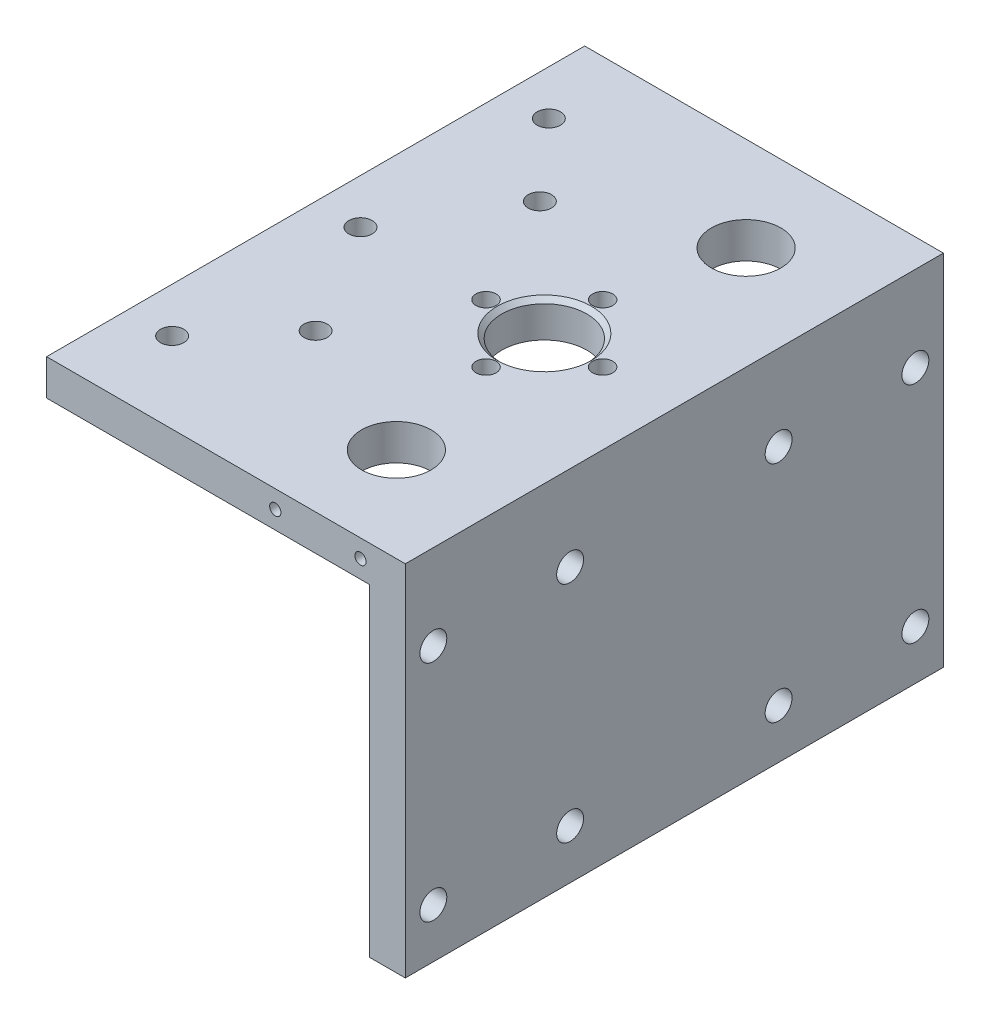
from build123d import *

# Parameters (mm, degrees)
ESTRUSIONE_ESTRUSIONE1_DEPTH = 120
TAGLIO_ESTRUSIONE2_REACH     = 166.924
SCHIZZO6_R                   = 7.75
TAGLIO_ESTRUSIONE3_REACH     = 166.924
SCHIZZO7_R                   = 9.5
FORO_PER_VITE_M4_2_D         = 4.5
SCHIZZO12_R                  = 3
TAGLIO_ESTRUSIONE4_DEPTH     = 10
SCHIZZO14_R                  = 2.6
TAGLIO_ESTRUSIONE5_DEPTH     = 10
SMUSSO2_SIZE                 = 1
FORO_FILETTATO_M3_1_D        = 2.5
FORO_FILETTATO_M3_1_DEPTH    = 10
FORO_FILETTATO_M3_1_TIP      = 0.751075774


with BuildPart() as part:
    # Schizzo1 → Estrusione-Estrusione1 (new body)
    with BuildSketch(Plane.XY):
        Polygon((0, 0), (-80, 0), (-80, -8), (-8, -8), (-8, -80), (0, -80), align=None)
    extrude(amount=ESTRUSIONE_ESTRUSIONE1_DEPTH)

    # Schizzo6 → Taglio-Estrusione2 (cut, up to next)
    with BuildSketch(Plane(origin=(0, 0, 0), x_dir=(1, 0, 0), z_dir=(0, 1, 0)), mode=Mode.PRIVATE) as taglio_estrusione2_sk1:
        with Locations(Location((-23, -21, 0), (0, 0, 180))):
            Circle(SCHIZZO6_R)
    taglio_estrusione2_tool1 = extrude(taglio_estrusione2_sk1.sketch, amount=-TAGLIO_ESTRUSIONE2_REACH, mode=Mode.PRIVATE) & part.part
    # Schizzo6 → Taglio-Estrusione2 (cut, up to next)
    with BuildSketch(Plane(origin=(0, 0, 0), x_dir=(1, 0, 0), z_dir=(0, 1, 0)), mode=Mode.PRIVATE) as taglio_estrusione2_sk2:
        with Locations(Location((-23, -99, 0), (0, 0, 180))):
            Circle(SCHIZZO6_R)
    taglio_estrusione2_tool2 = extrude(taglio_estrusione2_sk2.sketch, amount=-TAGLIO_ESTRUSIONE2_REACH, mode=Mode.PRIVATE) & part.part
    add(taglio_estrusione2_tool1.solids().sort_by_distance((-23, 0, 21))[0], mode=Mode.SUBTRACT)
    add(taglio_estrusione2_tool2.solids().sort_by_distance((-23, 0, 99))[0], mode=Mode.SUBTRACT)

    # Schizzo7 → Taglio-Estrusione3 (cut, up to next)
    with BuildSketch(Plane(origin=(0, 0, 0), x_dir=(1, 0, 0), z_dir=(0, 1, 0)), mode=Mode.PRIVATE) as taglio_estrusione3_sk1:
        with Locations(Location((-29, -60, 0), (0, 0, 180))):
            Circle(SCHIZZO7_R)
    taglio_estrusione3_tool1 = extrude(taglio_estrusione3_sk1.sketch, amount=-TAGLIO_ESTRUSIONE3_REACH, mode=Mode.PRIVATE) & part.part
    add(taglio_estrusione3_tool1.solids().sort_by_distance((-29, 0, 60))[0], mode=Mode.SUBTRACT)

    # Foro per Vite M4-2 (through all)
    with Locations(Plane(origin=(0, 0, 0), x_dir=(1, 0, 0), z_dir=(0, 1, 0))):
        with Locations((-29, -47), (-42, -60), (-29, -73), (-16, -60), (-29, -60)):
            Hole(FORO_PER_VITE_M4_2_D / 2)

    # Schizzo12 → Taglio-Estrusione4 (cut)
    with BuildSketch(Plane(origin=(0, 0, 0), x_dir=(0, 0, -1), z_dir=(1, 0, 0))):
        with Locations((-113.75, -19)):
            Circle(SCHIZZO12_R)
        with Locations(Location((-83.25, -19, 0), (0, 0, 90))):
            Circle(SCHIZZO12_R)
        with Locations((-36.75, -19)):
            Circle(SCHIZZO12_R)
        with Locations(Location((-6.25, -19, 0), (0, 0, 90))):
            Circle(SCHIZZO12_R)
        with Locations((-83.25, -69)):
            Circle(SCHIZZO12_R)
        with Locations(Location((-113.75, -69, 0), (0, 0, 90))):
            Circle(SCHIZZO12_R)
        with Locations((-6.25, -69)):
            Circle(SCHIZZO12_R)
        with Locations(Location((-36.75, -69, 0), (0, 0, 90))):
            Circle(SCHIZZO12_R)
    extrude(amount=-TAGLIO_ESTRUSIONE4_DEPTH, mode=Mode.SUBTRACT)

    # Schizzo14 → Taglio-Estrusione5 (cut)
    with BuildSketch(Plane(origin=(0, 0, 0), x_dir=(1, 0, 0), z_dir=(0, 1, 0))):
        with Locations(Location((-70, -18, 0), (0, 0, 180))):
            Circle(SCHIZZO14_R)
        with Locations(Location((-70, -60, 0), (0, 0, 180))):
            Circle(SCHIZZO14_R)
        with Locations(Location((-70, -102, 0), (0, 0, 180))):
            Circle(SCHIZZO14_R)
        with Locations(Location((-55, -35, 0), (0, 0, 180))):
            Circle(SCHIZZO14_R)
        with Locations(Location((-55, -85, 0), (0, 0, 180))):
            Circle(SCHIZZO14_R)
    extrude(amount=-TAGLIO_ESTRUSIONE5_DEPTH, mode=Mode.SUBTRACT)

    # Smusso2
    smusso2_edges = [part.edges().sort_by_distance(p)[0] for p in [
        (-19.5, 0, 60),
    ]]
    chamfer(smusso2_edges, length=SMUSSO2_SIZE)

    # Foro filettato M3-1
    with Locations(Plane.XY.offset(120)):
        with Locations((-10, -4), (-29, -4)):
            Hole(FORO_FILETTATO_M3_1_D / 2, depth=FORO_FILETTATO_M3_1_DEPTH)
            with Locations((0, 0, -(FORO_FILETTATO_M3_1_DEPTH + FORO_FILETTATO_M3_1_TIP / 2))):  # 118° drill point
                Cone(0, FORO_FILETTATO_M3_1_D / 2, FORO_FILETTATO_M3_1_TIP, mode=Mode.SUBTRACT)


solid = part.part
